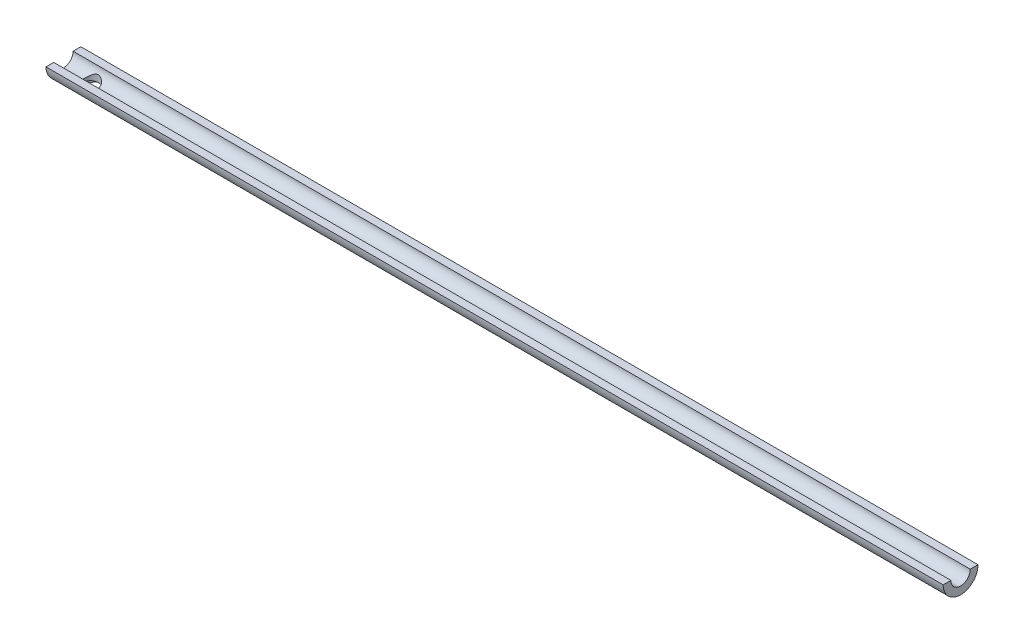
from build123d import *

# Parameters (mm, degrees)
SKETCH1_W                     = 735.584
SKETCH1_H                     = 38.1
WOOD_BLOCK_DEPTH              = 15.875
SKETCH2_R                     = 7.9375
INNER_BORE_DEPTH              = 737.741098814
SKETCH3_R                     = 6.35
MOUTHPIECE_THROUGH_HOLE_DEPTH = 737.741098814
SKETCH5_R                     = 8.128
CUT_EXTRUDE3_DEPTH            = 5.5499
SKETCH6_R                     = 8.128
CUT_EXTRUDE4_DEPTH            = 5.3975
SKETCH4_OUTSIDE_W             = 187.448
SKETCH4_OUTSIDE_H             = 165.223
SKETCH4_OUTSIDE_R             = 14.2875
OUTER_DIAMETER_DEPTH          = 737.741098916


with BuildPart() as part:
    # Sketch1 → wood block (new body)
    with BuildSketch(Plane(origin=(0, 0, 0), x_dir=(1, 0, 0), z_dir=(0, 1, 0))):
        with Locations((367.792, 19.05)):
            Rectangle(SKETCH1_W, SKETCH1_H)
    extrude(amount=WOOD_BLOCK_DEPTH)

    # Sketch2 → inner bore (cut, through all)
    with BuildSketch(Plane(origin=(735.584, 0, 0), x_dir=(0, 0, -1), z_dir=(1, 0, 0))):
        with Locations((19.05, 15.875)):
            Circle(SKETCH2_R)
    extrude(amount=-INNER_BORE_DEPTH, mode=Mode.SUBTRACT)

    # Sketch3 → mouthpiece through hole (cut, through all)
    with BuildSketch(Plane(origin=(0, 0, 0), x_dir=(1, 0, 0), z_dir=(0, 1, 0))):
        with Locations(Location((22.225, 19.05, 0), (0, 0, 90))):
            Circle(SKETCH3_R)
    extrude(amount=MOUTHPIECE_THROUGH_HOLE_DEPTH, mode=Mode.SUBTRACT)

    # Sketch5 → Cut-Extrude3 (cut)
    with BuildSketch(Plane.XZ):
        with Locations(Location((22.225, -19.05, 0), (0, 0, 270))):
            Circle(SKETCH5_R)
    extrude(amount=-CUT_EXTRUDE3_DEPTH, mode=Mode.SUBTRACT)

    # Sketch6 → Cut-Extrude4 (cut)
    with BuildSketch(Plane.XZ):
        with Locations(Location((713.359, -19.05, 0), (0, 0, 270))):
            Circle(SKETCH6_R)
    extrude(amount=-CUT_EXTRUDE4_DEPTH, mode=Mode.SUBTRACT)

    # Sketch4 outside → outer diameter (cut, through all)
    with BuildSketch(Plane.ZY):
        with Locations((-19.05, 7.9375)):
            Rectangle(SKETCH4_OUTSIDE_W, SKETCH4_OUTSIDE_H)
        with Locations((-19.05, 15.875)):
            Circle(SKETCH4_OUTSIDE_R, mode=Mode.SUBTRACT)
    extrude(amount=-OUTER_DIAMETER_DEPTH, mode=Mode.SUBTRACT)


solid = part.part
